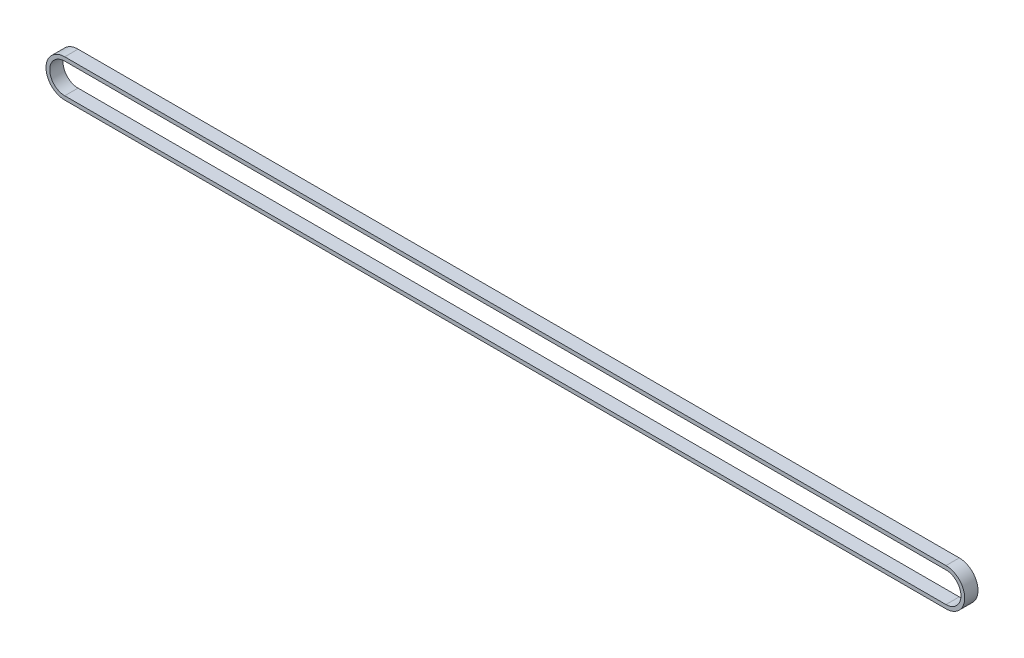
from build123d import *

# Parameters (mm, degrees)
EXTRUDE_THIN1_DEPTH = 4.5


with BuildPart() as part:
    # Sketch1 → Extrude-Thin1 (new, symmetric)
    with BuildSketch(Plane.XY):
        with BuildLine():
            Line((298.45, -12.7), (-298.45, -12.7))
            ThreePointArc((-298.45, -12.7), (-311.15, 0), (-298.45, 12.7))
            Line((-298.45, 12.7), (298.45, 12.7))
            ThreePointArc((298.45, 12.7), (311.15, 0), (298.45, -12.7))
        make_face()
        with BuildLine():
            Line((298.45, -10.16), (-298.45, -10.16))
            ThreePointArc((-298.45, -10.16), (-308.61, 0), (-298.45, 10.16))
            Line((-298.45, 10.16), (298.45, 10.16))
            ThreePointArc((298.45, 10.16), (308.61, 0), (298.45, -10.16))
        make_face(mode=Mode.SUBTRACT)
    extrude(amount=EXTRUDE_THIN1_DEPTH, both=True)


solid = part.part
